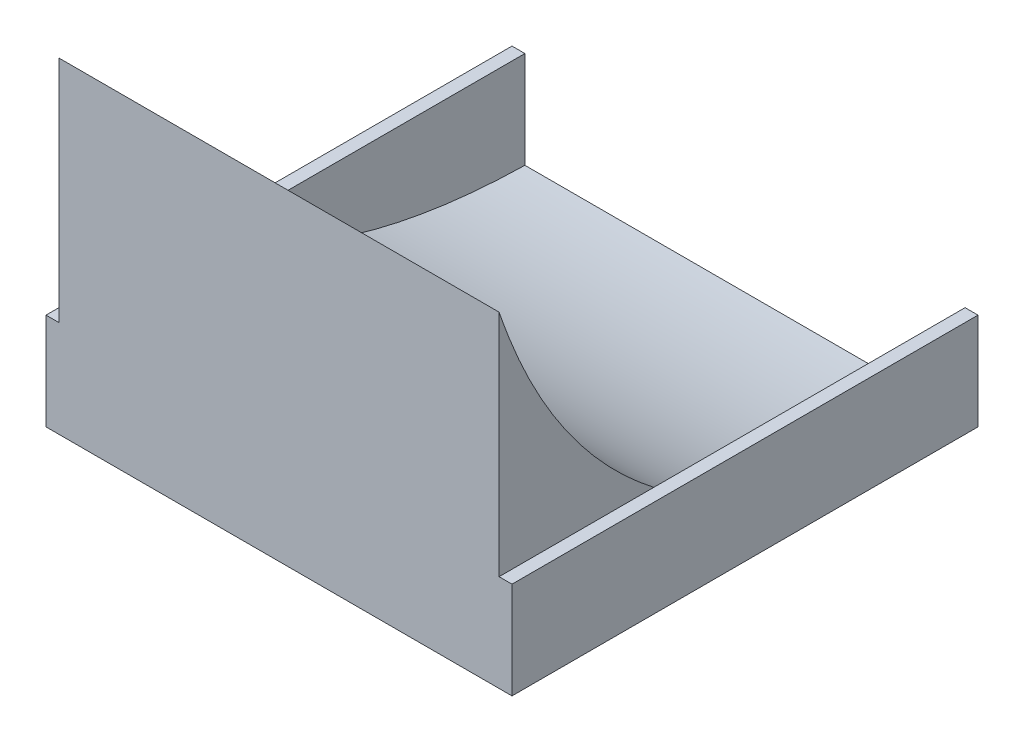
from build123d import *

# Parameters (mm, degrees)
BOSS_EXTRUDE1_DEPTH = 68.2
SKETCH2_W           = 72.2
SKETCH2_H           = 15
BOSS_EXTRUDE2_DEPTH = 2
SKETCH3_W           = 72.2
SKETCH3_H           = 15
BOSS_EXTRUDE3_DEPTH = 2


with BuildPart() as part:
    # Sketch1 → Boss-Extrude1 (new body)
    with BuildSketch(Plane(origin=(0, 0, 0), x_dir=(0, 0, -1), z_dir=(1, 0, 0))):
        with BuildLine():
            Line((0, 0), (72.2, 0))
            add(Edge.make_bspline(
                [(0, 50.5), (16.749312519, 1.14415236), (72.2, 0)],
                knots=[0, 0, 0, 1, 1, 1], degree=2))
            Line((0, 50.5), (0, 0))
        make_face()
    extrude(amount=BOSS_EXTRUDE1_DEPTH)

    # Sketch2 → Boss-Extrude2 (add)
    with BuildSketch(Plane.ZY):
        with Locations((-36.1, 7.5)):
            Rectangle(SKETCH2_W, SKETCH2_H)
    extrude(amount=BOSS_EXTRUDE2_DEPTH)

    # Sketch3 → Boss-Extrude3 (add)
    with BuildSketch(Plane(origin=(68.2, 0, 0), x_dir=(0, 0, -1), z_dir=(1, 0, 0))):
        with Locations((36.1, 7.5)):
            Rectangle(SKETCH3_W, SKETCH3_H)
    extrude(amount=BOSS_EXTRUDE3_DEPTH)


solid = part.part
